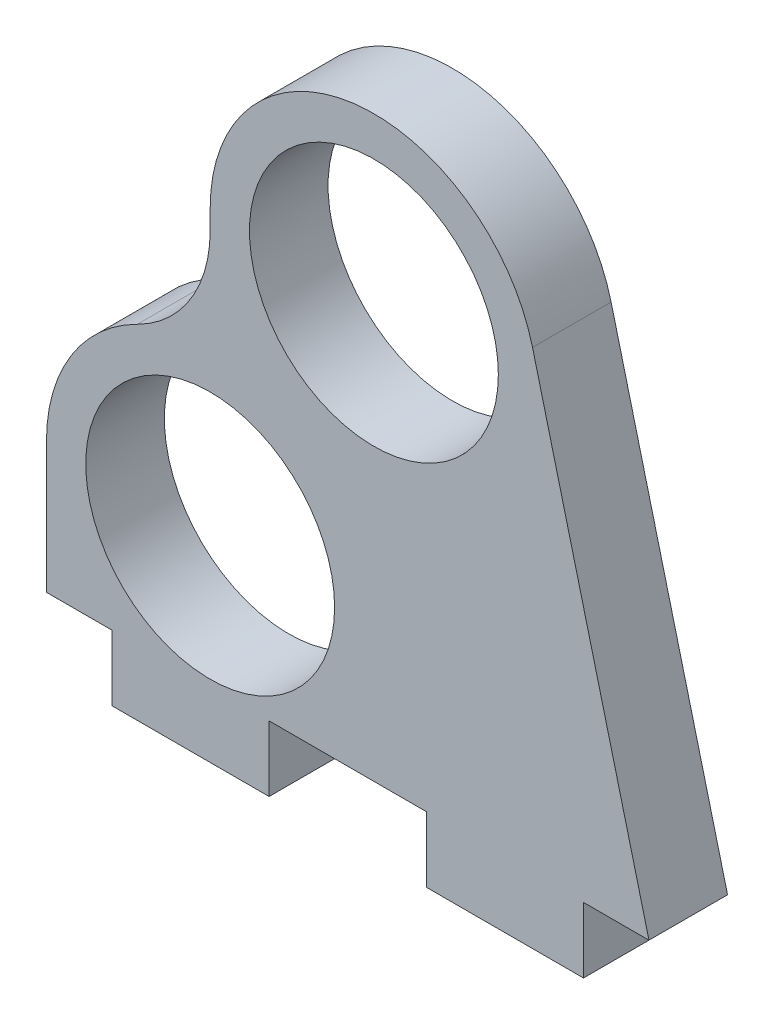
from build123d import *

# Parameters (mm, degrees)
CROQUIS1_R              = 9.5
SALIENTE_EXTRUIR1_DEPTH = 6


with BuildPart() as part:
    # Croquis1 → Saliente-Extruir1 (new body)
    with BuildSketch(Plane.XY):
        with BuildLine():
            Line((-12.5, 0), (-12.5, -10))
            Line((-12.5, -10), (-7.5, -10))
            Line((-7.5, -10), (-7.5, -15))
            Line((-7.5, -15), (4.5, -15))
            Line((4.5, -15), (4.5, -10))
            Line((4.5, -10), (16.5, -10))
            Line((16.5, -10), (16.5, -15))
            Line((16.5, -15), (28.5, -15))
            Line((28.5, -15), (28.5, -10))
            Line((28.5, -10), (33.5, -10))
            Line((33.5, -10), (24.60996669, 24.748813068))
            ThreePointArc((24.60996669, 24.748813068), (10.938683829, 34.052743456), (0, 21.650635095))
            Line((0, 21.650635095), (0, 20.155644371))
            ThreePointArc((0, 20.155644371), (-1.501634144, 14.885181604), (-5.555555556, 11.197580206))
            ThreePointArc((-5.555555556, 11.197580206), (-10.62295732, 6.588078459), (-12.5, 0))
        make_face()
        Circle(CROQUIS1_R, mode=Mode.SUBTRACT)
        with Locations((12.5, 21.650635095)):
            Circle(CROQUIS1_R, mode=Mode.SUBTRACT)
    extrude(amount=SALIENTE_EXTRUIR1_DEPTH)


solid = part.part
